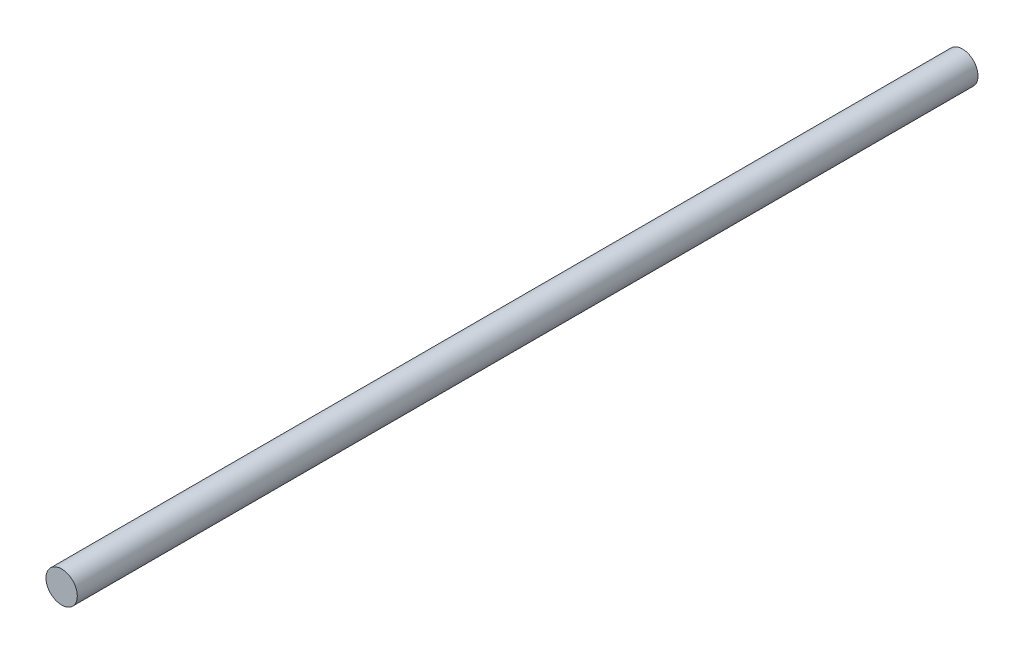
from build123d import *

# Parameters (mm, degrees)
ESBO_O1_R                = 4
RESSALTO_EXTRUS_O1_DEPTH = 230


with BuildPart() as part:
    # Esboço1 → Ressalto-extrusão1 (new body)
    with BuildSketch(Plane.XY):
        Circle(ESBO_O1_R)
    extrude(amount=RESSALTO_EXTRUS_O1_DEPTH)


solid = part.part
